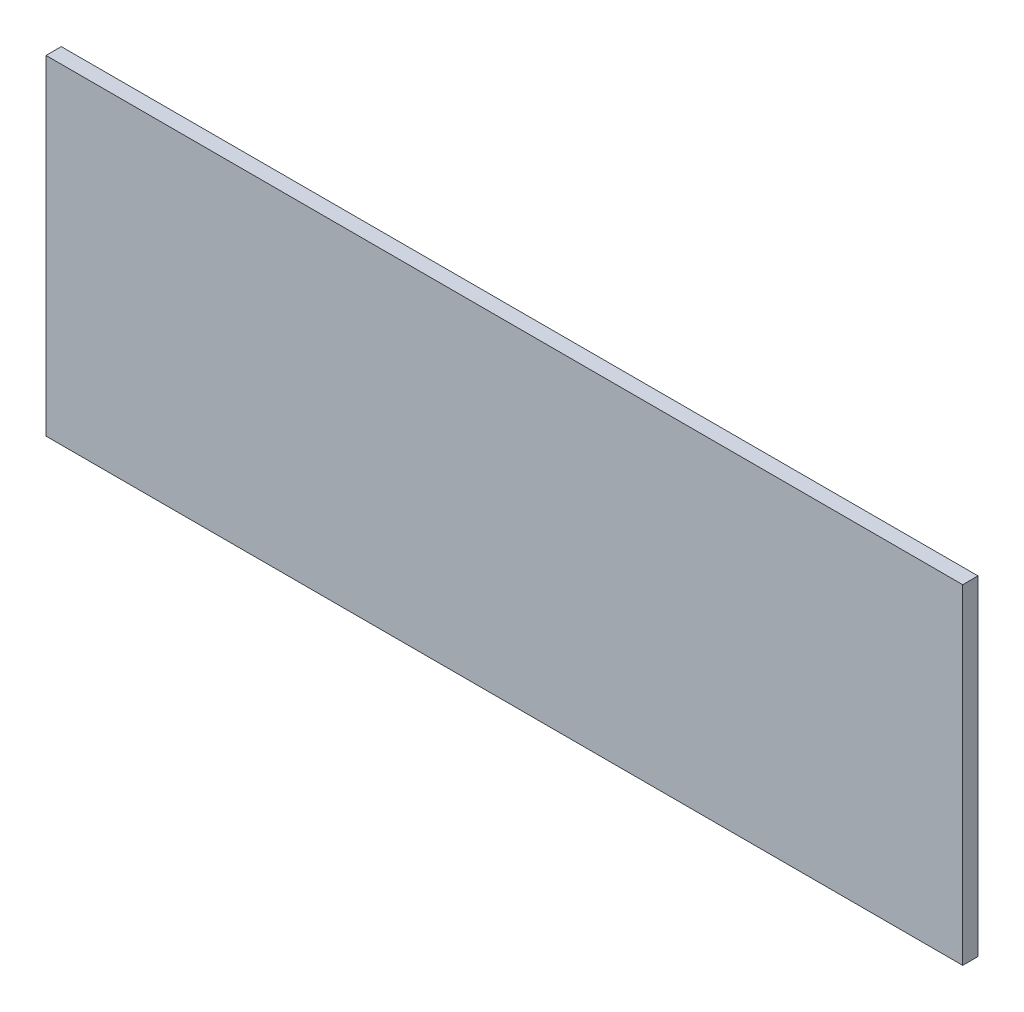
from build123d import *

# Parameters (mm, degrees)
ESQUISSE1_W        = 60
ESQUISSE1_H        = 21.58
BOSS_EXTRU_1_DEPTH = 1


with BuildPart() as part:
    # Esquisse1 → Boss.-Extru.1 (new body)
    with BuildSketch(Plane.XY):
        with Locations((12.040526575, 0.93826087)):
            Rectangle(ESQUISSE1_W, ESQUISSE1_H)
    extrude(amount=BOSS_EXTRU_1_DEPTH)


solid = part.part
